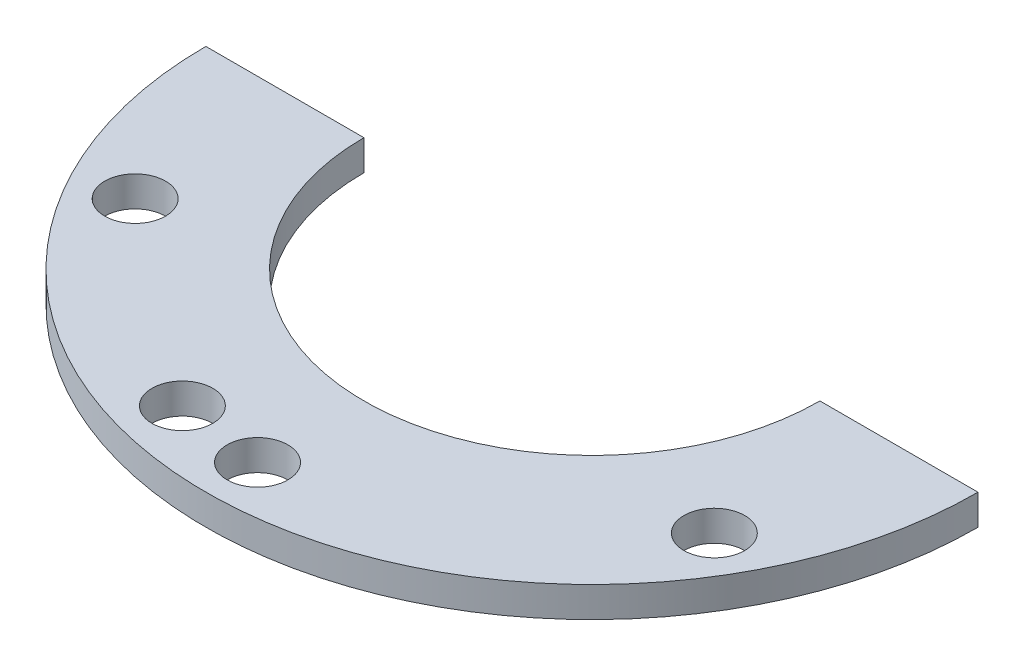
from build123d import *

# Parameters (mm, degrees)
SKETCH1_R               = 12.7
BOSS_EXTRUDE1_DEPTH     = 1
CUT_EXTRUDE1_DEPTH      = 18.98832955
CUT_EXTRUDE1_DEPTH_BACK = 18.98832955
SKETCH19_R              = 1
CUT_EXTRUDE2_DEPTH      = 18.98832955
CUT_EXTRUDE2_DEPTH_BACK = 18.98832955
SKETCH20_R              = 7.5
SKETCH21_W              = 65.874202484
SKETCH21_H              = 51.979273979
CUT_EXTRUDE3_DEPTH      = 18.98832955
CUT_EXTRUDE4_DEPTH      = 18.98832955
CUT_EXTRUDE4_DEPTH_BACK = 18.98832955
SKETCH23_R              = 1


with BuildPart() as part:
    # Sketch1 → Boss-Extrude1 (new body)
    with BuildSketch(Plane(origin=(0, 0, 0), x_dir=(1, 0, 0), z_dir=(0, 1, 0))):
        with Locations(Location((0, 0, 0), (0, 0, 270))):
            Circle(SKETCH1_R)
    extrude(amount=BOSS_EXTRUDE1_DEPTH)

    # Sketch19 → Cut-Extrude1 (cut, two sides: drawn at the far end of the back side and taken through both)
    with BuildSketch(Plane(origin=(0, 1, 0), x_dir=(1, 0, 0), z_dir=(0, 1, 0)).offset(-CUT_EXTRUDE1_DEPTH_BACK)):
        with Locations(Location((0, 11, 0), (0, 0, 270))):
            Circle(SKETCH19_R)
        with Locations(Location((9.526279442, 5.5, 0), (0, 0, 270))):
            Circle(SKETCH19_R)
        with Locations(Location((9.526279442, -5.5, 0), (0, 0, 270))):
            Circle(SKETCH19_R)
        with Locations(Location((0, -11, 0), (0, 0, 270))):
            Circle(SKETCH19_R)
        with Locations(Location((-9.526279442, -5.5, 0), (0, 0, 270))):
            Circle(SKETCH19_R)
        with Locations(Location((-9.526279442, 5.5, 0), (0, 0, 270))):
            Circle(SKETCH19_R)
    extrude(amount=CUT_EXTRUDE1_DEPTH + CUT_EXTRUDE1_DEPTH_BACK, mode=Mode.SUBTRACT)

    # Sketch20 → Cut-Extrude2 (cut, two sides: drawn at the far end of the back side and taken through both)
    with BuildSketch(Plane(origin=(0, 1, 0), x_dir=(1, 0, 0), z_dir=(0, 1, 0)).offset(-CUT_EXTRUDE2_DEPTH_BACK)):
        with Locations(Location((0, 0, 0), (0, 0, 270))):
            Circle(SKETCH20_R)
    extrude(amount=CUT_EXTRUDE2_DEPTH + CUT_EXTRUDE2_DEPTH_BACK, mode=Mode.SUBTRACT)

    # Sketch21 → Cut-Extrude3 (cut, through all)
    with BuildSketch(Plane.XY):
        with Locations((-3.816154381, 6.321647006)):
            Rectangle(SKETCH21_W, SKETCH21_H)
    extrude(amount=-CUT_EXTRUDE3_DEPTH, mode=Mode.SUBTRACT)

    # Sketch23 → Cut-Extrude4 (cut, two sides: drawn at the far end of the back side and taken through both)
    with BuildSketch(Plane(origin=(0, 1, 0), x_dir=(1, 0, 0), z_dir=(0, 1, 0)).offset(-CUT_EXTRUDE4_DEPTH_BACK)):
        with Locations(Location((-2.847009496, -10.625184089, 0), (0, 0, 270))):
            Circle(SKETCH23_R)
    extrude(amount=CUT_EXTRUDE4_DEPTH + CUT_EXTRUDE4_DEPTH_BACK, mode=Mode.SUBTRACT)


solid = part.part
